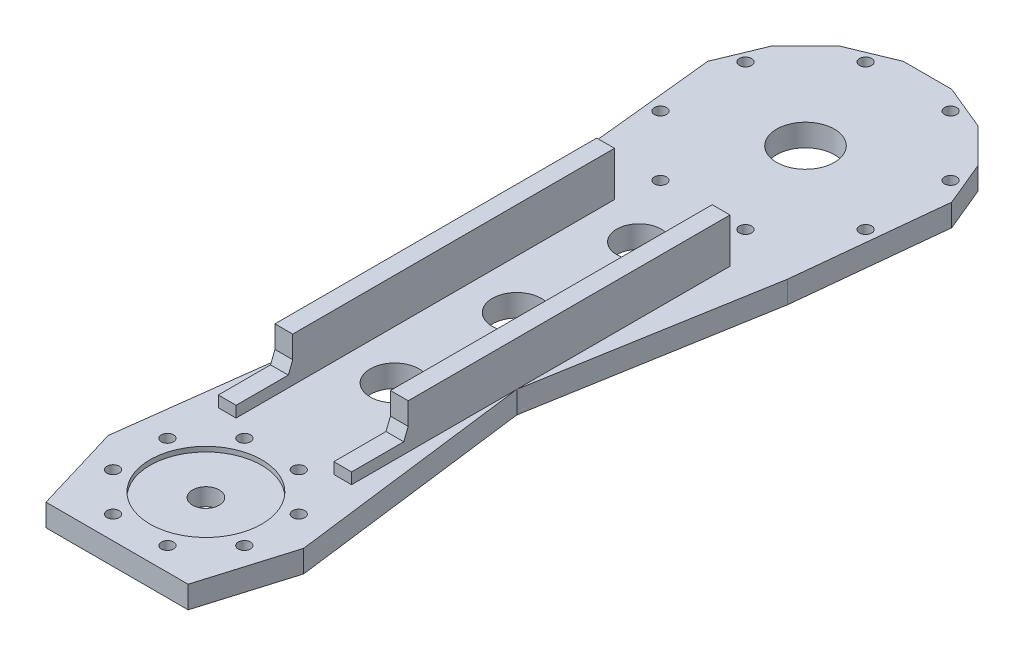
from build123d import *

# Parameters (mm, degrees)
SK_THIGH_PLATE_R         = 2.75
SK_THIGH_PLATE_R_2       = 6
SK_THIGH_PLATE_R_3       = 13
SK_THIGH_PLATE_R_4       = 11
SK_THIGH_PLATE_R_5       = 10
THIGH_PLATE_DEPTH        = 10
SK_PITCH_PILOT_RECESS_R  = 25.15
PITCH_PILOT_RECESS_DEPTH = 2.2
FRONT_FLANGE_DEPTH       = 8
BACK_FLANGE_DEPTH        = 8


with BuildPart() as part:
    # SK_Thigh_Plate → Thigh_Plate (new body)
    with BuildSketch(Plane(origin=(0, -46, 0), x_dir=(1, 0, 0), z_dir=(0, 1, 0))):
        Polygon((-32, -40), (32, -40), (44, 0), (30, 110), (48, 214), (54.923975703, 280.925058033), (46.562298289, 301.111933049), (31.111933049, 316.562298289), (10.925058033, 324.923975703), (-10.925058033, 324.923975703), (-31.111933049, 316.562298289), (-46.562298289, 301.111933049), (-54.923975703, 280.925058033), (-48, 214), (-30, 110), (-44, 0), align=None)
        with Locations((29.56414504, 12.245869836)):
            Circle(SK_THIGH_PLATE_R, mode=Mode.SUBTRACT)
        with Locations((12.245869836, 29.56414504)):
            Circle(SK_THIGH_PLATE_R, mode=Mode.SUBTRACT)
        with Locations((-12.245869836, 29.56414504)):
            Circle(SK_THIGH_PLATE_R, mode=Mode.SUBTRACT)
        with Locations((-29.56414504, 12.245869836)):
            Circle(SK_THIGH_PLATE_R, mode=Mode.SUBTRACT)
        with Locations((-29.56414504, -12.245869836)):
            Circle(SK_THIGH_PLATE_R, mode=Mode.SUBTRACT)
        with Locations((-12.245869836, -29.56414504)):
            Circle(SK_THIGH_PLATE_R, mode=Mode.SUBTRACT)
        with Locations((12.245869836, -29.56414504)):
            Circle(SK_THIGH_PLATE_R, mode=Mode.SUBTRACT)
        with Locations((29.56414504, -12.245869836)):
            Circle(SK_THIGH_PLATE_R, mode=Mode.SUBTRACT)
        with Locations((46.193976626, 289.134171618)):
            Circle(SK_THIGH_PLATE_R, mode=Mode.SUBTRACT)
        with Locations((19.134171618, 316.193976626)):
            Circle(SK_THIGH_PLATE_R, mode=Mode.SUBTRACT)
        with Locations((-19.134171618, 316.193976626)):
            Circle(SK_THIGH_PLATE_R, mode=Mode.SUBTRACT)
        with Locations((-46.193976626, 289.134171618)):
            Circle(SK_THIGH_PLATE_R, mode=Mode.SUBTRACT)
        with Locations((-46.193976626, 250.865828382)):
            Circle(SK_THIGH_PLATE_R, mode=Mode.SUBTRACT)
        with Locations((-19.134171618, 223.806023374)):
            Circle(SK_THIGH_PLATE_R, mode=Mode.SUBTRACT)
        with Locations((19.134171618, 223.806023374)):
            Circle(SK_THIGH_PLATE_R, mode=Mode.SUBTRACT)
        with Locations((46.193976626, 250.865828382)):
            Circle(SK_THIGH_PLATE_R, mode=Mode.SUBTRACT)
        Circle(SK_THIGH_PLATE_R_2, mode=Mode.SUBTRACT)
        with Locations((0, 270)):
            Circle(SK_THIGH_PLATE_R_3, mode=Mode.SUBTRACT)
        with Locations((0, 85)):
            Circle(SK_THIGH_PLATE_R_4, mode=Mode.SUBTRACT)
        with Locations((0, 140)):
            Circle(SK_THIGH_PLATE_R_4, mode=Mode.SUBTRACT)
        with Locations((0, 195)):
            Circle(SK_THIGH_PLATE_R_5, mode=Mode.SUBTRACT)
    extrude(amount=THIGH_PLATE_DEPTH)

    # SK_Pitch_Pilot_Recess → Pitch_Pilot_Recess (cut)
    with BuildSketch(Plane(origin=(0, -36, 0), x_dir=(1, 0, 0), z_dir=(0, 1, 0))):
        Circle(SK_PITCH_PILOT_RECESS_R)
    extrude(amount=-PITCH_PILOT_RECESS_DEPTH, mode=Mode.SUBTRACT)

    # SK_Front_Flange → Front_Flange (add)
    with BuildSketch(Plane(origin=(22, 0, 0), x_dir=(0, 0, -1), z_dir=(1, 0, 0))):
        Polygon((35.597687784, -31), (35.597687784, -36), (206, -36), (206, -16), (61.099916805, -16), (61.099916805, -26), (59.099916805, -31), align=None)
    extrude(amount=FRONT_FLANGE_DEPTH)

    # SK_Back_Flange → Back_Flange (add)
    with BuildSketch(Plane(origin=(-30, 0, 0), x_dir=(0, 0, -1), z_dir=(1, 0, 0))):
        Polygon((35.597687784, -31), (35.597687784, -36), (206, -36), (206, -16), (61.099916805, -16), (61.099916805, -26), (59.099916805, -31), align=None)
    extrude(amount=BACK_FLANGE_DEPTH)


solid = part.part
